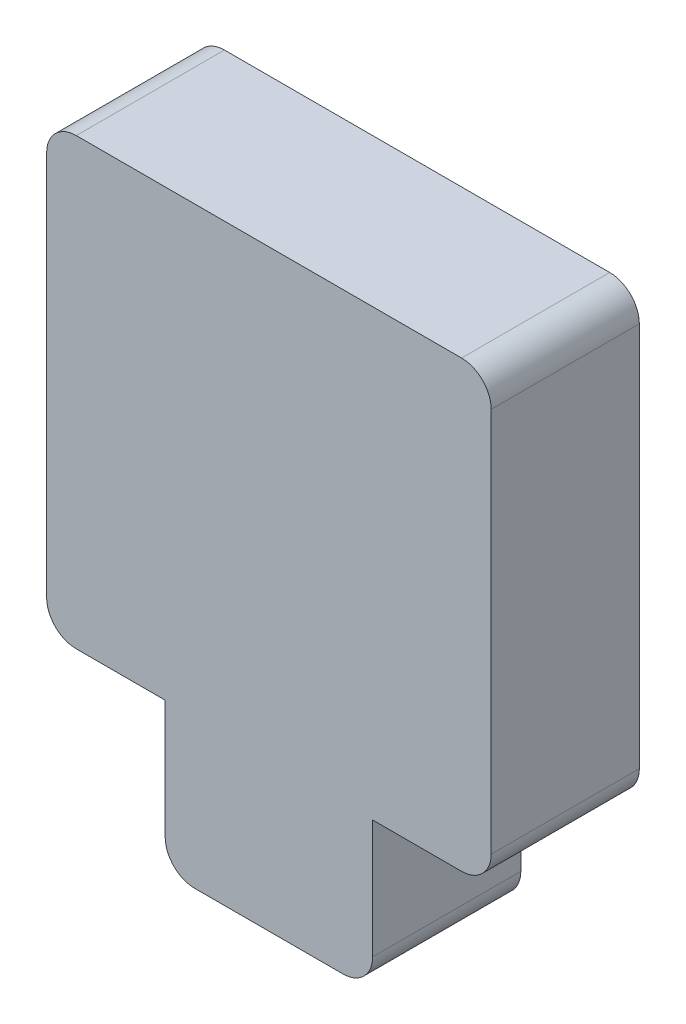
from build123d import *

# Parameters (mm, degrees)
SKETCH1_W           = 14
SKETCH1_H           = 10
SKETCH1_W_2         = 30
SKETCH1_H_2         = 30
BOSS_EXTRUDE1_DEPTH = 10
FILLET1_R           = 2


with BuildPart() as part:
    # Sketch1 → Boss-Extrude1 (new body)
    with BuildSketch(Plane.XY):
        with Locations((0, -5)):
            Rectangle(SKETCH1_W, SKETCH1_H)
        with Locations((0, 15)):
            Rectangle(SKETCH1_W_2, SKETCH1_H_2)
    extrude(amount=BOSS_EXTRUDE1_DEPTH)

    # Fillet1
    fillet1_edges = [part.edges().sort_by_distance(p)[0] for p in [
        (7, -10, 5),
        (-7, -10, 5),
        (-15, 0, 5),
        (-15, 30, 5),
        (15, 30, 5),
        (15, 0, 5),
    ]]
    fillet(fillet1_edges, radius=FILLET1_R)


solid = part.part
